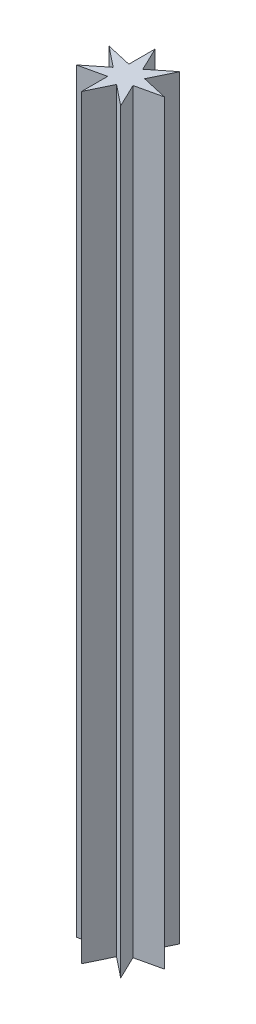
from build123d import *

# Parameters (mm, degrees)
BOSS_EXTRUDE1_DEPTH = 127


with BuildPart() as part:
    # Sketch1 → Boss-Extrude1 (new body)
    with BuildSketch(Plane(origin=(0, 0, 0), x_dir=(1, 0, 0), z_dir=(0, 1, 0))):
        Polygon((-1.413007931, -6.190792242), (0.504296692, -2.20946817), (3.959160242, -4.964629914), (2.041855619, -0.983305842), (6.35, 0), (2.041855619, 0.983305842), (3.959160242, 4.964629914), (0.504296692, 2.20946817), (-1.413007931, 6.190792242), (-1.413007931, 1.771855902), (-5.721152311, 2.755161743), (-2.266288761, 0), (-5.721152311, -2.755161743), (-1.413007931, -1.771855902), align=None)
    extrude(amount=BOSS_EXTRUDE1_DEPTH)


solid = part.part
